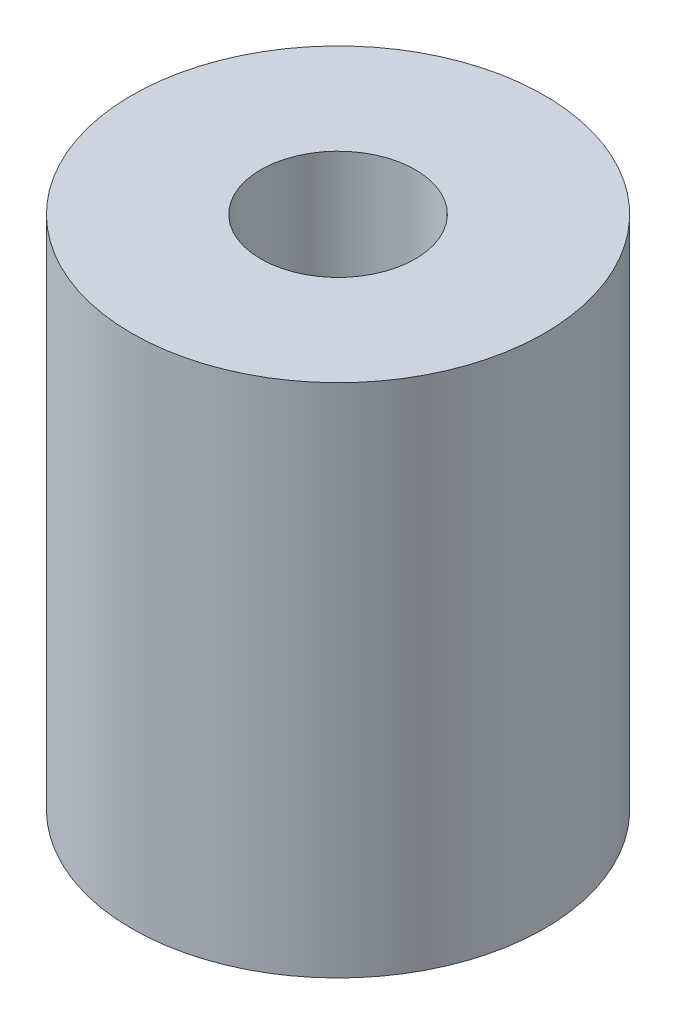
from build123d import *

# Parameters (mm, degrees)
SKETCH1_R           = 4
BOSS_EXTRUDE1_DEPTH = 10
SKETCH2_R           = 1.5
CUT_EXTRUDE1_DEPTH  = 12.489125293


with BuildPart() as part:
    # Sketch1 → Boss-Extrude1 (new body)
    with BuildSketch(Plane(origin=(0, 0, 0), x_dir=(1, 0, 0), z_dir=(0, 1, 0))):
        with Locations(Location((0, 0, 0), (0, 0, 270))):
            Circle(SKETCH1_R)
    extrude(amount=BOSS_EXTRUDE1_DEPTH)

    # Sketch2 → Cut-Extrude1 (cut, through all)
    with BuildSketch(Plane(origin=(0, 10, 0), x_dir=(1, 0, 0), z_dir=(0, 1, 0))):
        with Locations(Location((0, 0, 0), (0, 0, 270))):
            Circle(SKETCH2_R)
    extrude(amount=-CUT_EXTRUDE1_DEPTH, mode=Mode.SUBTRACT)


solid = part.part
